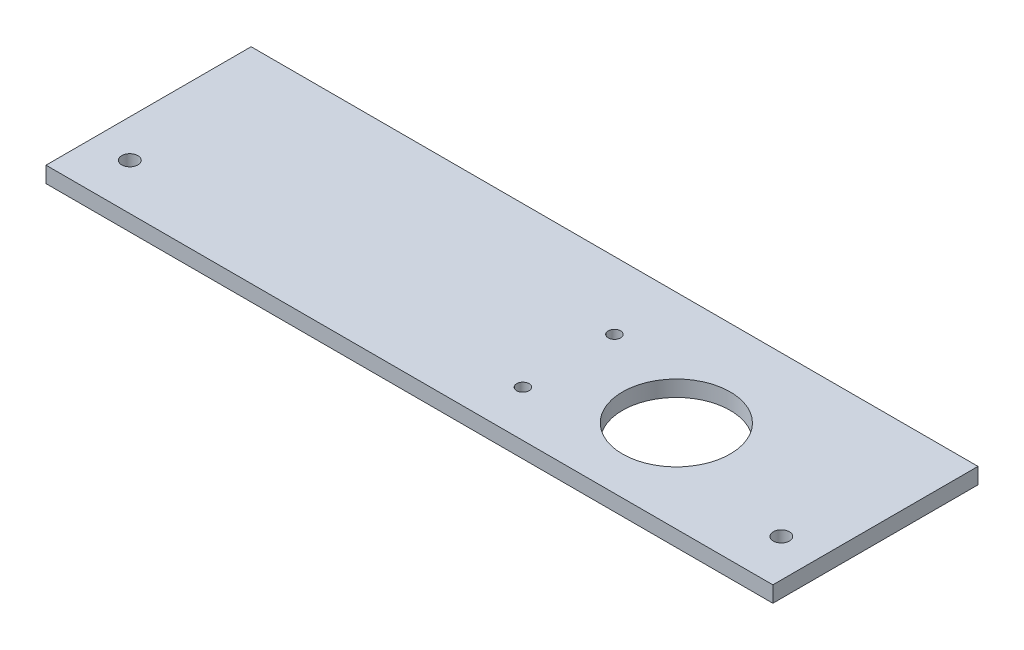
from build123d import *

# Parameters (mm, degrees)
SKETCH1_W           = 135
SKETCH1_H           = 38.1
SKETCH1_R           = 1.15
SKETCH1_R_2         = 10
BOSS_EXTRUDE1_DEPTH = 2.9718
SKETCH2_R           = 1.5
CUT_EXTRUDE1_DEPTH  = 141.304816721


with BuildPart() as part:
    # Sketch1 → Boss-Extrude1 (new body)
    with BuildSketch(Plane(origin=(0, 0, 0), x_dir=(1, 0, 0), z_dir=(0, 1, 0))):
        with Locations((67.5, 19.05)):
            Rectangle(SKETCH1_W, SKETCH1_H)
        with Locations(Location((80, 8.5718, 0), (0, 0, 270))):
            Circle(SKETCH1_R, mode=Mode.SUBTRACT)
        with Locations(Location((80, 25.5718, 0), (0, 0, 270))):
            Circle(SKETCH1_R, mode=Mode.SUBTRACT)
        with Locations(Location((100, 17.0718, 0), (0, 0, 270))):
            Circle(SKETCH1_R_2, mode=Mode.SUBTRACT)
    extrude(amount=BOSS_EXTRUDE1_DEPTH)

    # Sketch2 → Cut-Extrude1 (cut, through all)
    with BuildSketch(Plane(origin=(0, 2.9718, 0), x_dir=(1, 0, 0), z_dir=(0, 1, 0))):
        with Locations(Location((128, 8.5718, 0), (0, 0, 270))):
            Circle(SKETCH2_R)
        with Locations(Location((7, 8.5718, 0), (0, 0, 270))):
            Circle(SKETCH2_R)
    extrude(amount=-CUT_EXTRUDE1_DEPTH, mode=Mode.SUBTRACT)


solid = part.part
